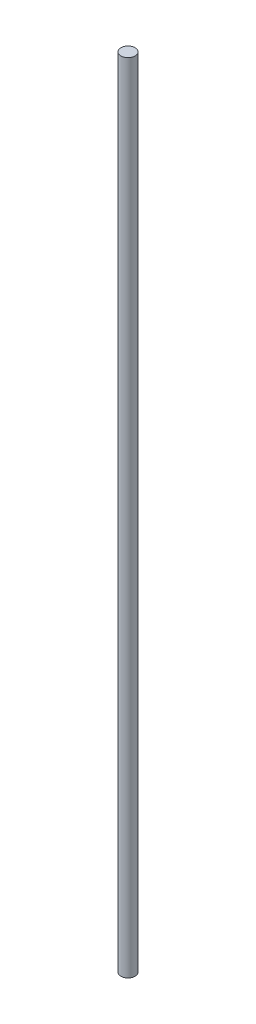
from build123d import *

# Parameters (mm, degrees)
SKETCH1_R           = 3.175
BOSS_EXTRUDE1_DEPTH = 354.95000008


with BuildPart() as part:
    # Sketch1 → Boss-Extrude1 (new body)
    with BuildSketch(Plane(origin=(0, 0, 0), x_dir=(1, 0, 0), z_dir=(0, 1, 0))):
        with Locations(Location((0, 0, 0), (0, 0, 90))):
            Circle(SKETCH1_R)
    extrude(amount=BOSS_EXTRUDE1_DEPTH)


solid = part.part
